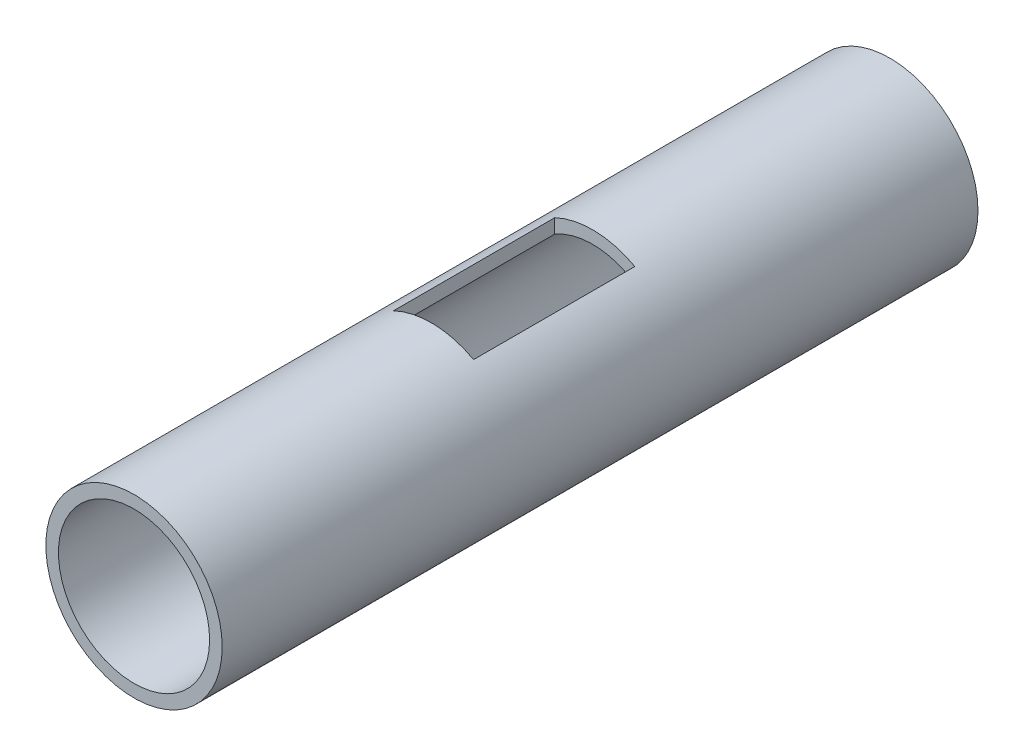
from build123d import *

# Parameters (mm, degrees)
ESBO_O1_R                  = 7
RESSALTO_EXTRUS_O1_DEPTH   = 60
ESBO_O2_R                  = 6
CORTE_EXTRUS_O1_DEPTH      = 71
CORTE_EXTRUS_O2_DEPTH      = 21
CORTE_EXTRUS_O2_DEPTH_BACK = 21
ESBO_O3_W                  = 6.357761197
ESBO_O3_H                  = 12.7967598


with BuildPart() as part:
    # Esboço1 → Ressalto-extrusão1 (new body)
    with BuildSketch(Plane.XY):
        with Locations((-19.442180611, 6.398692353)):
            Circle(ESBO_O1_R)
    extrude(amount=RESSALTO_EXTRUS_O1_DEPTH)

    # Esboço2 → Corte-extrusão1 (cut)
    with BuildSketch(Plane.XY.offset(60)):
        with Locations((-19.442180611, 6.398692353)):
            Circle(ESBO_O2_R)
    extrude(amount=-CORTE_EXTRUS_O1_DEPTH, mode=Mode.SUBTRACT)

    # Esboço3 → Corte-extrusão2 (cut, two sides: drawn at the far end of the back side and taken through both)
    with BuildSketch(Plane(origin=(0, 0, 0), x_dir=(1, 0, 0), z_dir=(0, 1, 0)).offset(-CORTE_EXTRUS_O2_DEPTH_BACK)):
        with Locations((-19.265634303, -29.9983799)):
            Rectangle(ESBO_O3_W, ESBO_O3_H)
    extrude(amount=CORTE_EXTRUS_O2_DEPTH + CORTE_EXTRUS_O2_DEPTH_BACK, mode=Mode.SUBTRACT)


solid = part.part
